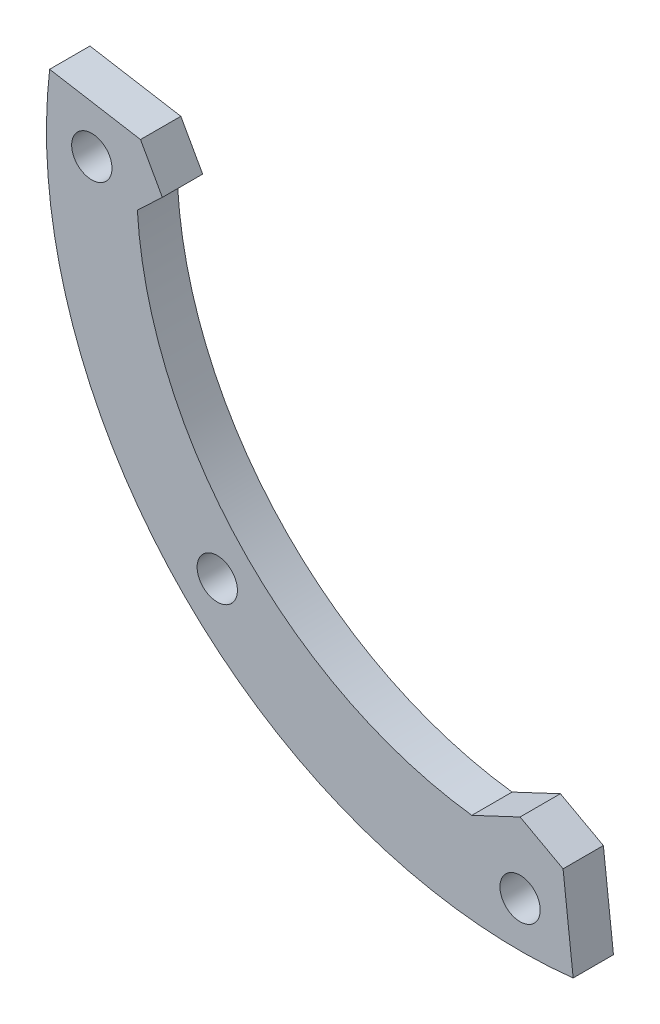
from build123d import *

# Parameters (mm, degrees)
SKETCH_3_R      = 2
EXTRUDE_1_DEPTH = 4


with BuildPart() as part:
    # 草图3 → 凸台-拉伸1 (new body)
    with BuildSketch(Plane.XY):
        with BuildLine():
            Line((-37.667405861, 56.89708202), (-46.686841808, 58.42631375))
            ThreePointArc((-46.686841808, 58.42631375), (-33.287089683, 19.828920451), (5.267276505, 6.30586701))
            Line((5.267276505, 6.30586701), (4.265537779, 15.188089459))
            Line((4.265537779, 15.188089459), (0, 17.509783315))
            Line((0, 17.509783315), (-4.788956139, 15.257523407))
            ThreePointArc((-4.788956139, 15.257523407), (-27.767557087, 26.988061571), (-37.98334573, 50.67897311))
            Line((-37.98334573, 50.67897311), (-35.5, 53.009783315))
            Line((-35.5, 53.009783315), (-37.667405861, 56.89708202))
        make_face()
        with Locations((0, 10.509783315)):
            Circle(SKETCH_3_R, mode=Mode.SUBTRACT)
        with Locations((-30.0520382, 22.957745114)):
            Circle(SKETCH_3_R, mode=Mode.SUBTRACT)
        with Locations((-42.5, 53.009783315)):
            Circle(SKETCH_3_R, mode=Mode.SUBTRACT)
    extrude(amount=EXTRUDE_1_DEPTH)


solid = part.part
